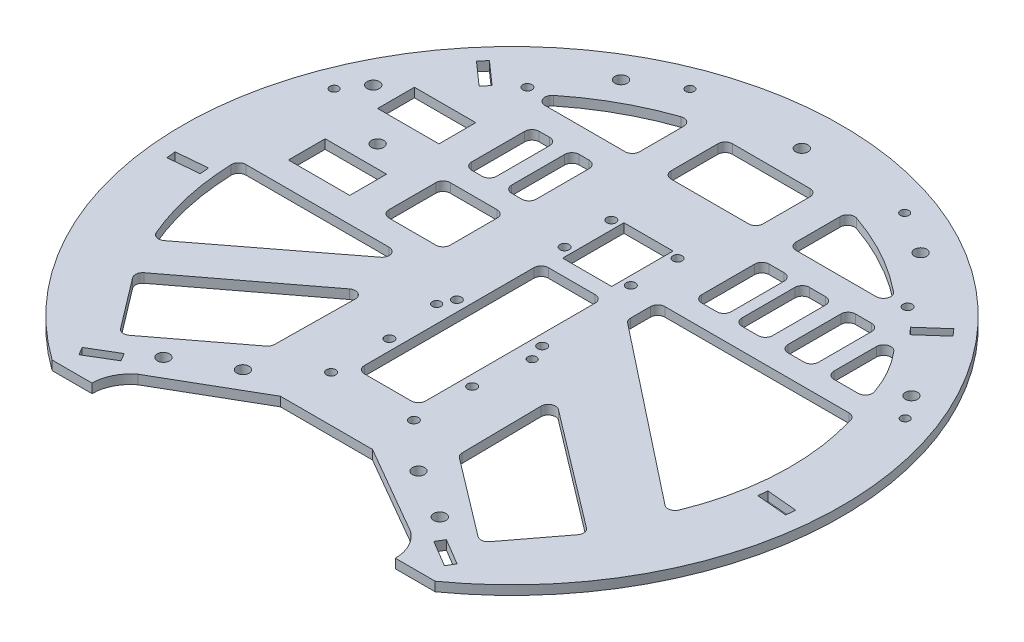
from build123d import *

# Parameters (mm, degrees)
SKETCH3_R               = 2
SKETCH3_R_2             = 1.4
SKETCH3_R_3             = 1.5
SKETCH3_W               = 20
SKETCH3_H               = 12
SKETCH3_W_2             = 16
SKETCH3_H_2             = 20
TAPA_DEPTH              = 3
SKETCH4_R               = 1.4
HOLES_DE_SOPORTES_DEPTH = 30
CUT_EXTRUDE1_DEPTH      = 10


with BuildPart() as part:
    # Sketch3 → Tapa (new body)
    with BuildSketch(Plane(origin=(0, 0, 0), x_dir=(1, 0, 0), z_dir=(0, 1, 0))):
        with BuildLine():
            Line((62.449979984, -87.5), (49.449979984, -87.5))
            ThreePointArc((49.449979984, -87.5), (48.12884185, -81.908685559), (44.444863729, -77.5))
            Line((44.444863729, -77.5), (15, -60.5))
            Line((15, -60.5), (-15, -60.5))
            Line((-15, -60.5), (-44.444863729, -77.5))
            ThreePointArc((-44.444863729, -77.5), (-48.12884185, -81.908685559), (-49.449979984, -87.5))
            Line((-49.449979984, -87.5), (-62.449979984, -87.5))
            ThreePointArc((-62.449979984, -87.5), (0, 107.5), (62.449979984, -87.5))
        make_face()
        with Locations(Location((-28.619465419, -59.125597719, 0), (0, 0, 270))):
            Circle(SKETCH3_R, mode=Mode.SUBTRACT)
        with Locations(Location((-45.055316759, -68.614840914, 0), (0, 0, 270))):
            Circle(SKETCH3_R, mode=Mode.SUBTRACT)
        with Locations(Location((28.619203384, -59.125446433, 0), (0, 0, 270))):
            Circle(SKETCH3_R, mode=Mode.SUBTRACT)
        with Locations(Location((87.750139617, 42.498976426, 0), (0, 0, 270))):
            Circle(SKETCH3_R, mode=Mode.SUBTRACT)
        with Locations(Location((48.839202179, 84.385913104, 0), (0, 0, 270))):
            Circle(SKETCH3_R, mode=Mode.SUBTRACT)
        with Locations(Location((-15.588826206, -8.999360951, 0), (0, 0, 270))):
            Circle(SKETCH3_R_2, mode=Mode.SUBTRACT)
        with Locations(Location((-70.427839512, 26.60521986, 0), (0, 0, 270))):
            Circle(SKETCH3_R, mode=Mode.SUBTRACT)
        with Locations(Location((-87.749795418, 42.499687105, 0), (0, 0, 270))):
            Circle(SKETCH3_R, mode=Mode.SUBTRACT)
        with Locations(Location((-48.839202179, 84.385913104, 0), (0, 0, 270))):
            Circle(SKETCH3_R, mode=Mode.SUBTRACT)
        with Locations(Location((45.054923707, -68.614613986, 0), (0, 0, 270))):
            Circle(SKETCH3_R, mode=Mode.SUBTRACT)
        with Locations(Location((-62, 67.000000058, 0), (0, 0, 270))):
            Circle(SKETCH3_R_3, mode=Mode.SUBTRACT)
        with Locations(Location((62, 67.000000058, 0), (0, 0, 90))):
            Circle(SKETCH3_R_3, mode=Mode.SUBTRACT)
        with Locations(Location((0, 94.5, 0), (0, 0, 270))):
            Circle(SKETCH3_R, mode=Mode.SUBTRACT)
        with Locations(Location((15.588541243, -8.999854549, 0), (0, 0, 270))):
            Circle(SKETCH3_R_2, mode=Mode.SUBTRACT)
        with Locations(Location((13.5, -26.5, 0), (0, 0, 270))):
            Circle(SKETCH3_R_3, mode=Mode.SUBTRACT)
        with Locations(Location((-13.5, -26.5, 0), (0, 0, 90))):
            Circle(SKETCH3_R_3, mode=Mode.SUBTRACT)
        with Locations(Location((-13.5, -4.5, 0), (0, 0, 270))):
            Circle(SKETCH3_R_3, mode=Mode.SUBTRACT)
        with Locations(Location((13.5, -3.65037689, 0), (0, 0, 270))):
            Circle(SKETCH3_R_3, mode=Mode.SUBTRACT)
        with Locations(Location((-10.795, 43.18, 0), (0, 0, 270))):
            Circle(SKETCH3_R_3, mode=Mode.SUBTRACT)
        with Locations(Location((10.795, 43.18, 0), (0, 0, 270))):
            Circle(SKETCH3_R_3, mode=Mode.SUBTRACT)
        with Locations(Location((-10.795, 27.94, 0), (0, 0, 270))):
            Circle(SKETCH3_R_3, mode=Mode.SUBTRACT)
        with Locations(Location((10.795, 27.94, 0), (0, 0, 270))):
            Circle(SKETCH3_R_3, mode=Mode.SUBTRACT)
        with Locations(Location((-13.5, -45.5, 0), (0, 0, 270))):
            Circle(SKETCH3_R_3, mode=Mode.SUBTRACT)
        with Locations(Location((13.5, -45.5, 0), (0, 0, 270))):
            Circle(SKETCH3_R_3, mode=Mode.SUBTRACT)
        with BuildLine():
            Line((7.638584232, -40.5), (-7.638584232, -40.5))
            ThreePointArc((-7.638584232, -40.5), (-9.308357335, -39.808357335), (-10, -38.138584232))
            Line((-10, -38.138584232), (-10, 17.138584232))
            ThreePointArc((-10, 17.138584232), (-9.308357335, 18.808357335), (-7.638584232, 19.5))
            Line((-7.638584232, 19.5), (7.638584232, 19.5))
            ThreePointArc((7.638584232, 19.5), (9.308357335, 18.808357335), (10, 17.138584232))
            Line((10, 17.138584232), (10, -38.138584232))
            ThreePointArc((10, -38.138584232), (9.308357335, -39.808357335), (7.638584232, -40.5))
        make_face(mode=Mode.SUBTRACT)
        with BuildLine():
            Line((63.117545464, 36.861415768), (63.117545464, 54.138584232))
            ThreePointArc((63.117545464, 54.138584232), (62.425902798, 55.808357335), (60.756129696, 56.5))
            Line((60.756129696, 56.5), (55.478961232, 56.5))
            ThreePointArc((55.478961232, 56.5), (53.809188129, 55.808357335), (53.117545464, 54.138584232))
            Line((53.117545464, 54.138584232), (53.117545464, 36.861415768))
            ThreePointArc((53.117545464, 36.861415768), (53.809188129, 35.191642665), (55.478961232, 34.5))
            Line((55.478961232, 34.5), (60.756129696, 34.5))
            ThreePointArc((60.756129696, 34.5), (62.425902798, 35.191642665), (63.117545464, 36.861415768))
        make_face(mode=Mode.SUBTRACT)
        with BuildLine():
            Line((-34.050559725, -18.927501521), (-72.11890078, -47.837579926))
            ThreePointArc((-72.11890078, -47.837579926), (-73.030377903, -49.398259664), (-72.571322332, -51.146338544))
            Line((-72.571322332, -51.146338544), (-60.166742424, -67.480496203))
            ThreePointArc((-60.166742424, -67.480496203), (-58.606062686, -68.391973326), (-56.857983805, -67.932917755))
            Line((-56.857983805, -67.932917755), (-31.531513314, -48.699343942))
            ThreePointArc((-31.531513314, -48.699343942), (-30.851256, -47.882156355), (-30.598464594, -46.849372704))
            Line((-30.598464594, -46.849372704), (-30.261173939, -20.838710454))
            ThreePointArc((-30.261173939, -20.838710454), (-31.558988693, -18.699665759), (-34.050559725, -18.927501521))
        make_face(mode=Mode.SUBTRACT)
        with BuildLine():
            Line((-37.939220648, -4.926477804), (-77.87707487, -35.483247866))
            ThreePointArc((-77.87707487, -35.483247866), (-79.915519505, -35.890791962), (-81.486260434, -34.529130605))
            ThreePointArc((-81.486260434, -34.529130605), (-86.403277556, -19.150590786), (-88.444588976, -3.134673953))
            ThreePointArc((-88.444588976, -3.134673953), (-87.783742422, -1.411097791), (-86.084654961, -0.689616848))
            Line((-86.084654961, -0.689616848), (-39.374138685, -0.689616848))
            ThreePointArc((-39.374138685, -0.689616848), (-37.137512849, -2.293543808), (-37.939220648, -4.926477804))
        make_face(mode=Mode.SUBTRACT)
        with BuildLine():
            Line((-30, 9.87179892), (-30, 25.148967384))
            ThreePointArc((-30, 25.148967384), (-30.691642665, 26.818740487), (-32.361415768, 27.510383152))
            Line((-32.361415768, 27.510383152), (-47.638584232, 27.510383152))
            ThreePointArc((-47.638584232, 27.510383152), (-49.308357335, 26.818740487), (-50, 25.148967384))
            Line((-50, 25.148967384), (-50, 9.87179892))
            ThreePointArc((-50, 9.87179892), (-49.308357335, 8.202025817), (-47.638584232, 7.510383152))
            Line((-47.638584232, 7.510383152), (-32.361415768, 7.510383152))
            ThreePointArc((-32.361415768, 7.510383152), (-30.691642665, 8.202025817), (-30, 9.87179892))
        make_face(mode=Mode.SUBTRACT)
        with Locations((-70.427839512, 13.510383152)):
            Rectangle(SKETCH3_W, SKETCH3_H, mode=Mode.SUBTRACT)
        with Locations((-70.427839512, 42.60521986)):
            Rectangle(SKETCH3_W, SKETCH3_H, mode=Mode.SUBTRACT)
        with BuildLine():
            Line((-41.882454536, 36.861415768), (-41.882454536, 54.138584232))
            ThreePointArc((-41.882454536, 54.138584232), (-42.574097202, 55.808357335), (-44.243870304, 56.5))
            Line((-44.243870304, 56.5), (-47.638584232, 56.5))
            ThreePointArc((-47.638584232, 56.5), (-49.308357335, 55.808357335), (-50, 54.138584232))
            Line((-50, 54.138584232), (-50, 36.861415768))
            ThreePointArc((-50, 36.861415768), (-49.308357335, 35.191642665), (-47.638584232, 34.5))
            Line((-47.638584232, 34.5), (-44.243870304, 34.5))
            ThreePointArc((-44.243870304, 34.5), (-42.574097202, 35.191642665), (-41.882454536, 36.861415768))
        make_face(mode=Mode.SUBTRACT)
        with Locations((0, 34.5)):
            Rectangle(SKETCH3_W_2, SKETCH3_H_2, mode=Mode.SUBTRACT)
        with BuildLine():
            Line((20, 18.645573032), (20, 25.138584232))
            ThreePointArc((20, 25.138584232), (20.691642665, 26.808357335), (22.361415768, 27.5))
            Line((22.361415768, 27.5), (82.386822327, 27.5))
            ThreePointArc((82.386822327, 27.5), (83.794025912, 27.034912921), (84.646924565, 25.822851945))
            ThreePointArc((84.646924565, 25.822851945), (87.99074285, -1.120260852), (82.130846073, -27.630146888))
            ThreePointArc((82.130846073, -27.630146888), (80.546709658, -29.020077347), (78.48333408, -28.591269591))
            Line((78.48333408, -28.591269591), (20.89973717, 16.790908613))
            ThreePointArc((20.89973717, 16.790908613), (20.23680812, 17.614880657), (20, 18.645573032))
        make_face(mode=Mode.SUBTRACT)
        with BuildLine():
            Line((78.328216259, 34.5), (70.478961232, 34.5))
            ThreePointArc((70.478961232, 34.5), (68.809188129, 35.191642665), (68.117545464, 36.861415768))
            Line((68.117545464, 36.861415768), (68.117545464, 50.694284592))
            ThreePointArc((68.117545464, 50.694284592), (69.663734251, 52.910517747), (72.277498544, 52.22449633))
            ThreePointArc((72.277498544, 52.22449633), (77.112368817, 45.314907016), (80.564275458, 37.620575623))
            ThreePointArc((80.564275458, 37.620575623), (80.24771834, 35.485989947), (78.328216259, 34.5))
        make_face(mode=Mode.SUBTRACT)
        with BuildLine():
            Line((45.756129696, 34.5), (40.478961232, 34.5))
            ThreePointArc((40.478961232, 34.5), (38.809188129, 35.191642665), (38.117545464, 36.861415768))
            Line((38.117545464, 36.861415768), (38.117545464, 54.138584232))
            ThreePointArc((38.117545464, 54.138584232), (38.809188129, 55.808357335), (40.478961232, 56.5))
            Line((40.478961232, 56.5), (45.756129696, 56.5))
            ThreePointArc((45.756129696, 56.5), (47.425902798, 55.808357335), (48.117545464, 54.138584232))
            Line((48.117545464, 54.138584232), (48.117545464, 36.861415768))
            ThreePointArc((48.117545464, 36.861415768), (47.425902798, 35.191642665), (45.756129696, 34.5))
        make_face(mode=Mode.SUBTRACT)
        with BuildLine():
            Line((30.261173939, -20.838710454), (30.598464594, -46.849372704))
            ThreePointArc((30.598464594, -46.849372704), (30.851256, -47.882156355), (31.531513314, -48.699343942))
            Line((31.531513314, -48.699343942), (56.857983805, -67.932917755))
            ThreePointArc((56.857983805, -67.932917755), (58.606062686, -68.391973326), (60.166742424, -67.480496203))
            Line((60.166742424, -67.480496203), (72.571322332, -51.146338544))
            ThreePointArc((72.571322332, -51.146338544), (73.030377903, -49.398259664), (72.11890078, -47.837579926))
            Line((72.11890078, -47.837579926), (34.050559725, -18.927501521))
            ThreePointArc((34.050559725, -18.927501521), (31.558988693, -18.699665759), (30.261173939, -20.838710454))
        make_face(mode=Mode.SUBTRACT)
        with BuildLine():
            Line((-25.5, 67.108097119), (-25.5, 81.508264642))
            ThreePointArc((-25.5, 81.508264642), (-26.487981695, 83.429192354), (-28.625212702, 83.74274415))
            ThreePointArc((-28.625212702, 83.74274415), (-42.700153992, 77.517397074), (-55.483778956, 68.947808325))
            ThreePointArc((-55.483778956, 68.947808325), (-56.230497857, 66.323252746), (-54.003323922, 64.746681351))
            Line((-54.003323922, 64.746681351), (-27.861415768, 64.746681351))
            ThreePointArc((-27.861415768, 64.746681351), (-26.191642665, 65.438324016), (-25.5, 67.108097119))
        make_face(mode=Mode.SUBTRACT)
        with BuildLine():
            Line((25.5, 67.108097119), (25.5, 81.508264642))
            ThreePointArc((25.5, 81.508264642), (26.487981695, 83.429192354), (28.625212702, 83.74274415))
            ThreePointArc((28.625212702, 83.74274415), (42.700153992, 77.517397074), (55.483778956, 68.947808325))
            ThreePointArc((55.483778956, 68.947808325), (56.230497857, 66.323252746), (54.003323922, 64.746681351))
            Line((54.003323922, 64.746681351), (27.861415768, 64.746681351))
            ThreePointArc((27.861415768, 64.746681351), (26.191642665, 65.438324016), (25.5, 67.108097119))
        make_face(mode=Mode.SUBTRACT)
        with BuildLine():
            Line((-36.957643907, 54.138584232), (-36.957643907, 36.861415768))
            ThreePointArc((-36.957643907, 36.861415768), (-36.266001242, 35.191642665), (-34.596228139, 34.5))
            Line((-34.596228139, 34.5), (-31.319059675, 34.5))
            ThreePointArc((-31.319059675, 34.5), (-29.649286572, 35.191642665), (-28.957643907, 36.861415768))
            Line((-28.957643907, 36.861415768), (-28.957643907, 54.138584232))
            ThreePointArc((-28.957643907, 54.138584232), (-29.649286572, 55.808357335), (-31.319059675, 56.5))
            Line((-31.319059675, 56.5), (-34.596228139, 56.5))
            ThreePointArc((-34.596228139, 56.5), (-36.266001242, 55.808357335), (-36.957643907, 54.138584232))
        make_face(mode=Mode.SUBTRACT)
        with BuildLine():
            Line((34.617545464, 54.138584232), (34.617545464, 36.861415768))
            ThreePointArc((34.617545464, 36.861415768), (33.925902798, 35.191642665), (32.256129696, 34.5))
            Line((32.256129696, 34.5), (27.348757938, 34.5))
            ThreePointArc((27.348757938, 34.5), (25.678984835, 35.191642665), (24.98734217, 36.861415768))
            Line((24.98734217, 36.861415768), (24.98734217, 54.138584232))
            ThreePointArc((24.98734217, 54.138584232), (25.678984835, 55.808357335), (27.348757938, 56.5))
            Line((27.348757938, 56.5), (32.256129696, 56.5))
            ThreePointArc((32.256129696, 56.5), (33.925902798, 55.808357335), (34.617545464, 54.138584232))
        make_face(mode=Mode.SUBTRACT)
        with BuildLine():
            Line((-15, 66.861415768), (-15, 82.138584232))
            ThreePointArc((-15, 82.138584232), (-14.308357335, 83.808357335), (-12.638584232, 84.5))
            Line((-12.638584232, 84.5), (12.638584232, 84.5))
            ThreePointArc((12.638584232, 84.5), (14.308357335, 83.808357335), (15, 82.138584232))
            Line((15, 82.138584232), (15, 66.861415768))
            ThreePointArc((15, 66.861415768), (14.308357335, 65.191642665), (12.638584232, 64.5))
            Line((12.638584232, 64.5), (-12.638584232, 64.5))
            ThreePointArc((-12.638584232, 64.5), (-14.308357335, 65.191642665), (-15, 66.861415768))
        make_face(mode=Mode.SUBTRACT)
    extrude(amount=TAPA_DEPTH)

    # Sketch4 → Holes de soportes (cut)
    with BuildSketch(Plane(origin=(0, 3, 0), x_dir=(1, 0, 0), z_dir=(0, 1, 0))):
        with Locations(Location((-93.103383397, 35.1, 0), (0, 0, 270))):
            Circle(SKETCH4_R)
        with Locations(Location((35, 93.034187265, 0), (0, 0, 90))):
            Circle(SKETCH4_R)
        with Locations(Location((58, -78.993670633, 0), (0, 0, 90))):
            Circle(SKETCH4_R)
        with Locations(Location((-35, 93.034187265, 0), (0, 0, 270))):
            Circle(SKETCH4_R)
        with Locations(Location((93.103383397, 35.1, 0), (0, 0, 90))):
            Circle(SKETCH4_R)
        with Locations(Location((-58, -78.993670633, 0), (0, 0, 270))):
            Circle(SKETCH4_R)
    extrude(amount=-HOLES_DE_SOPORTES_DEPTH, mode=Mode.SUBTRACT)

    # Sketch6 → Cut-Extrude1 (cut)
    with BuildSketch(Plane(origin=(0, 3, 0), x_dir=(1, 0, 0), z_dir=(0, 1, 0))):
        Polygon((-59.590222061, -81.624575095), (-61.12759459, -79.048437344), (-52.540468755, -73.92386225), (-51.003096227, -76.5), align=None)
        Polygon((59.590222061, -81.624575095), (61.12759459, -79.048437344), (52.540468755, -73.92386225), (51.003096227, -76.5), align=None)
        Polygon((101.17241918, -8.667383439), (91.17241918, -7.755552333), (90.9, -10.743158029), (100.9, -11.654989134), align=None)
        Polygon((-100.9, -11.654989134), (-101.17241918, -8.667383439), (-91.17241918, -7.755552333), (-90.9, -10.743158029), align=None)
        Polygon((-77.70280139, 66.108380167), (-75.71415707, 68.354553306), (-68.226913275, 61.725738906), (-70.215557595, 59.479565767), align=None)
        Polygon((70.215557595, 59.479565767), (68.226913275, 61.725738906), (75.71415707, 68.354553306), (77.70280139, 66.108380167), align=None)
    extrude(amount=-CUT_EXTRUDE1_DEPTH, mode=Mode.SUBTRACT)


solid = part.part
